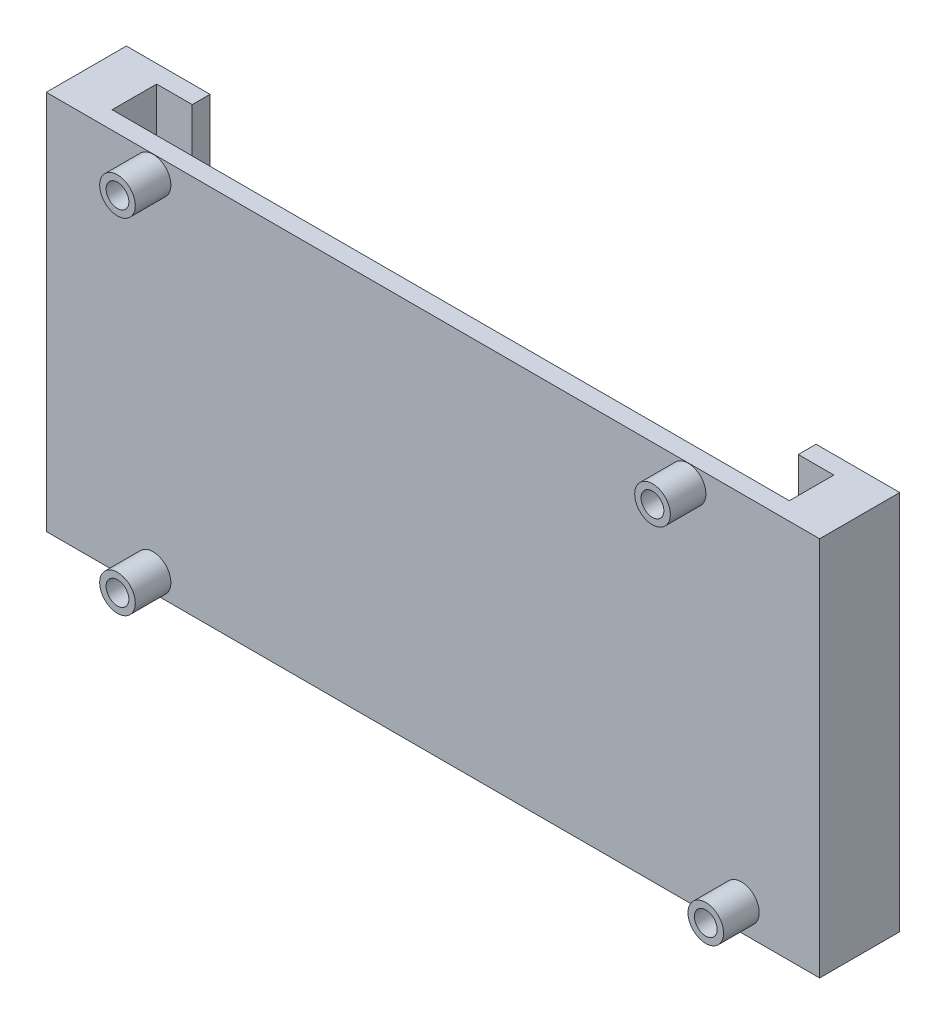
from build123d import *

# Parameters (mm, degrees)
SKETCH1_W            = 108.6
SKETCH1_H            = 53.4162
BOSS_EXTRUDE1_DEPTH  = 2.5
SKETCH2_R            = 2.5
BOSS_EXTRUDE2_DEPTH  = 5
M3_CLEARANCE_HOLE1_D = 3.2
SKETCH5_W            = 6.75
SKETCH5_H            = 53.4162
BOSS_EXTRUDE3_DEPTH  = 8.75
SKETCH6_W            = 2.5
SKETCH6_H            = 53.4162
BOSS_EXTRUDE4_DEPTH  = 5
SKETCH7_W            = 2.5
SKETCH7_H            = 53.4162
BOSS_EXTRUDE5_DEPTH  = 5
SKETCH8_R            = 3.15
CUT_EXTRUDE1_DEPTH   = 2.7


with BuildPart() as part:
    # Sketch1 → Boss-Extrude1 (new body)
    with BuildSketch(Plane.XY):
        Rectangle(SKETCH1_W, SKETCH1_H)
    extrude(amount=BOSS_EXTRUDE1_DEPTH)

    # Sketch2 → Boss-Extrude2 (add)
    with BuildSketch(Plane.XY.offset(2.5)):
        with Locations(Location((-39.3, 24.1681, 0), (0, 0, 180))):
            Circle(SKETCH2_R)
        with Locations(Location((35.83, 24.1681, 0), (0, 0, 180))):
            Circle(SKETCH2_R)
        with Locations(Location((43.311856292, -23.00810902, 0), (0, 0, 180))):
            Circle(SKETCH2_R)
        with Locations(Location((-39.3, -24.16810902, 0), (0, 0, 180))):
            Circle(SKETCH2_R)
    extrude(amount=BOSS_EXTRUDE2_DEPTH)

    # M3 Clearance Hole1 (through all)
    with Locations(Plane.XY.offset(7.5)):
        with Locations((-39.3, 24.1681), (35.83, 24.1681), (43.311856292, -23.00810902), (-39.3, -24.16810902)):
            Hole(M3_CLEARANCE_HOLE1_D / 2)

    # Sketch5 → Boss-Extrude3 (add)
    with BuildSketch(Plane(origin=(0, 0, 0), x_dir=(-1, 0, 0), z_dir=(0, 0, -1))):
        with Locations((-50.925, 0)):
            Rectangle(SKETCH5_W, SKETCH5_H)
        with Locations((50.925, 0)):
            Rectangle(SKETCH5_W, SKETCH5_H)
    extrude(amount=BOSS_EXTRUDE3_DEPTH)

    # Sketch6 → Boss-Extrude4 (add)
    with BuildSketch(Plane.ZY.offset(-47.55)):
        with Locations((-7.5, 0)):
            Rectangle(SKETCH6_W, SKETCH6_H)
    extrude(amount=BOSS_EXTRUDE4_DEPTH)

    # Sketch7 → Boss-Extrude5 (add)
    with BuildSketch(Plane(origin=(-47.55, 0, 0), x_dir=(0, 0, -1), z_dir=(1, 0, 0))):
        with Locations((7.5, 0)):
            Rectangle(SKETCH7_W, SKETCH7_H)
    extrude(amount=BOSS_EXTRUDE5_DEPTH)

    # Sketch8 → Cut-Extrude1 (cut)
    with BuildSketch(Plane.XZ.offset(26.7081)):
        with Locations(Location((-50.925, -3.125, 0), (0, 0, 270))):
            Circle(SKETCH8_R)
        with Locations(Location((50.925, -3.125, 0), (0, 0, 270))):
            Circle(SKETCH8_R)
    extrude(amount=-CUT_EXTRUDE1_DEPTH, mode=Mode.SUBTRACT)


solid = part.part
